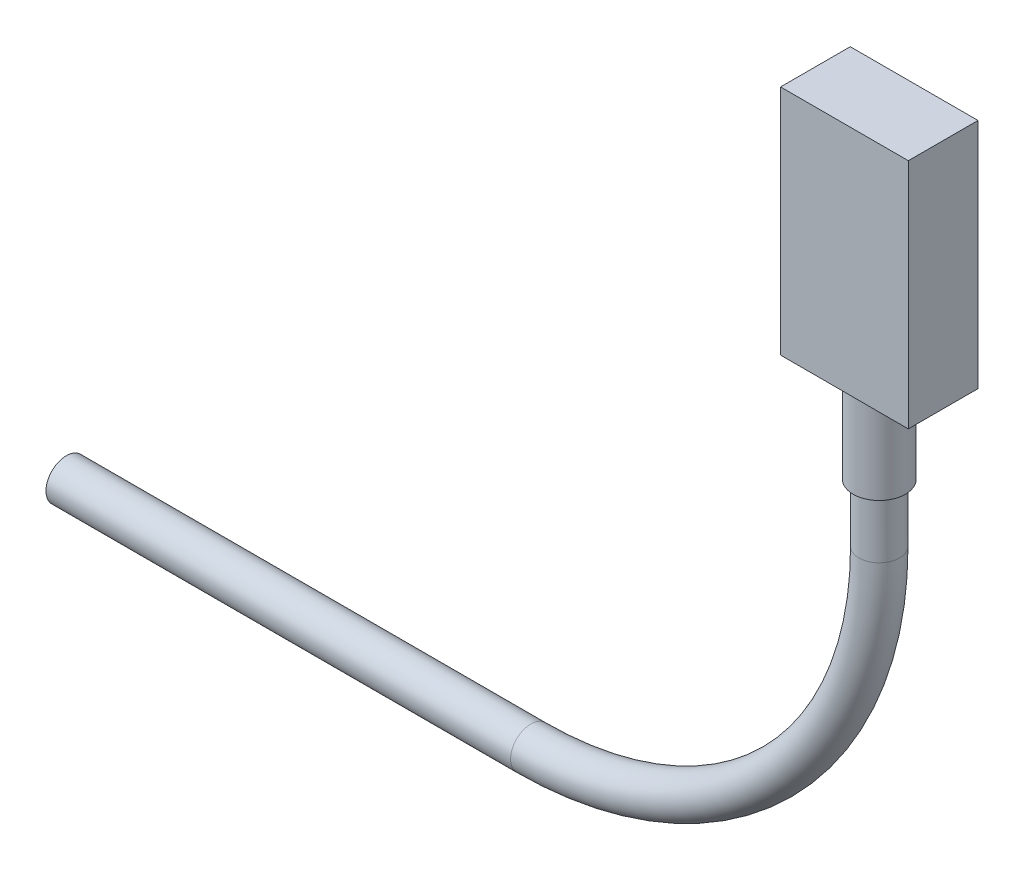
from build123d import *

# Parameters (mm, degrees)
SKETCH1_W           = 11
SKETCH1_H           = 6
OVERMOULD_DEPTH     = 20
SKETCH2_R           = 2.25
STRAIN_RELIEF_DEPTH = 8
LEAD_PROFILE_R      = 1.75


with BuildPart() as part:
    # Sketch1 → Overmould (new body)
    with BuildSketch(Plane(origin=(0, 0, 0), x_dir=(1, 0, 0), z_dir=(0, 1, 0))):
        Rectangle(SKETCH1_W, SKETCH1_H)
    extrude(amount=-OVERMOULD_DEPTH)

    # Sketch2 → Strain_relief (add)
    with BuildSketch(Plane(origin=(0, -20, 0), x_dir=(1, 0, 0), z_dir=(0, 1, 0))):
        with Locations(Location((0, 0, 0), (0, 0, 270))):
            Circle(SKETCH2_R)
    extrude(amount=-STRAIN_RELIEF_DEPTH)

    # Lead: sweep along a path in Sketch3
    with BuildLine(Plane.XY) as lead_path:
        Line((0, -28), (0, -33))
        ThreePointArc((0, -33), (-8.786796564, -54.213203436), (-30, -63))
        Line((-30, -63), (-70, -63))
    # Lead profile (on start of the path) → Lead (sweep)
    with BuildSketch(Plane(origin=(0, -28, 0), x_dir=(0, 0, -1), z_dir=(0, -1, 0))):
        Circle(LEAD_PROFILE_R)
    sweep(path=lead_path.line)


solid = part.part
